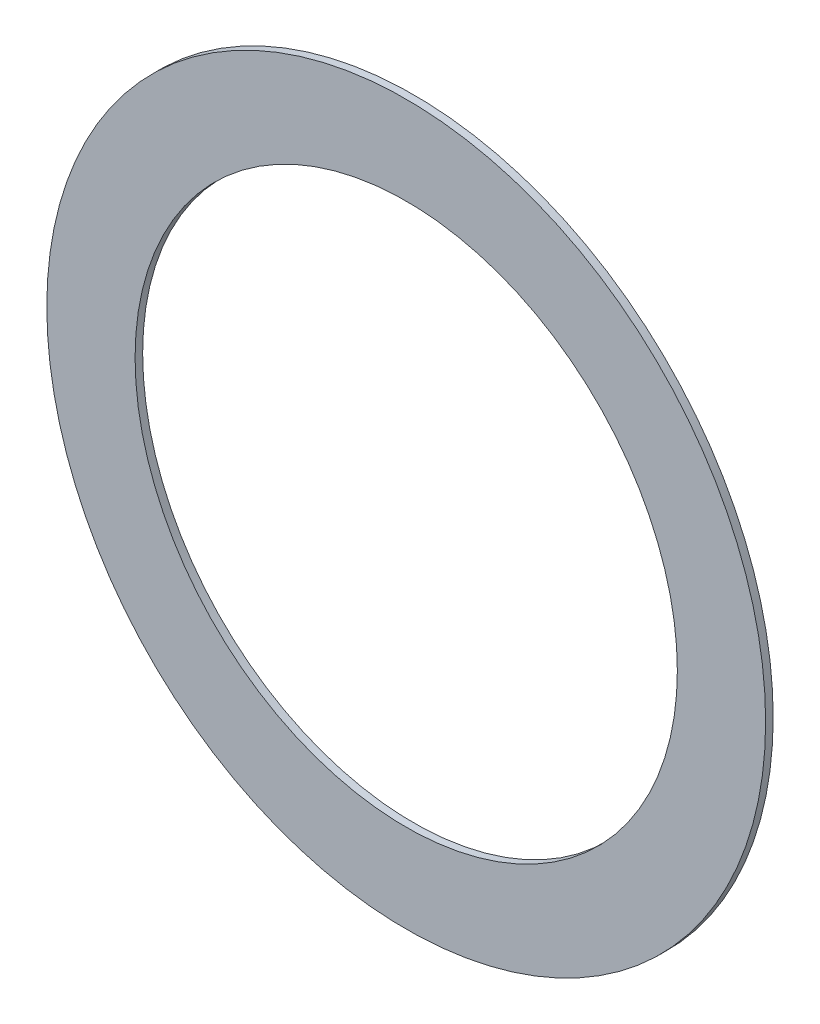
from build123d import *

# Parameters (mm, degrees)
SKETCH_1_R      = 28.5
SKETCH_1_R_2    = 21.5
EXTRUDE_1_DEPTH = 0.6


with BuildPart() as part:
    # 草圖1 → 填料-伸長1 (new body)
    with BuildSketch(Plane.XY):
        Circle(SKETCH_1_R)
        Circle(SKETCH_1_R_2, mode=Mode.SUBTRACT)
    extrude(amount=EXTRUDE_1_DEPTH)


solid = part.part
